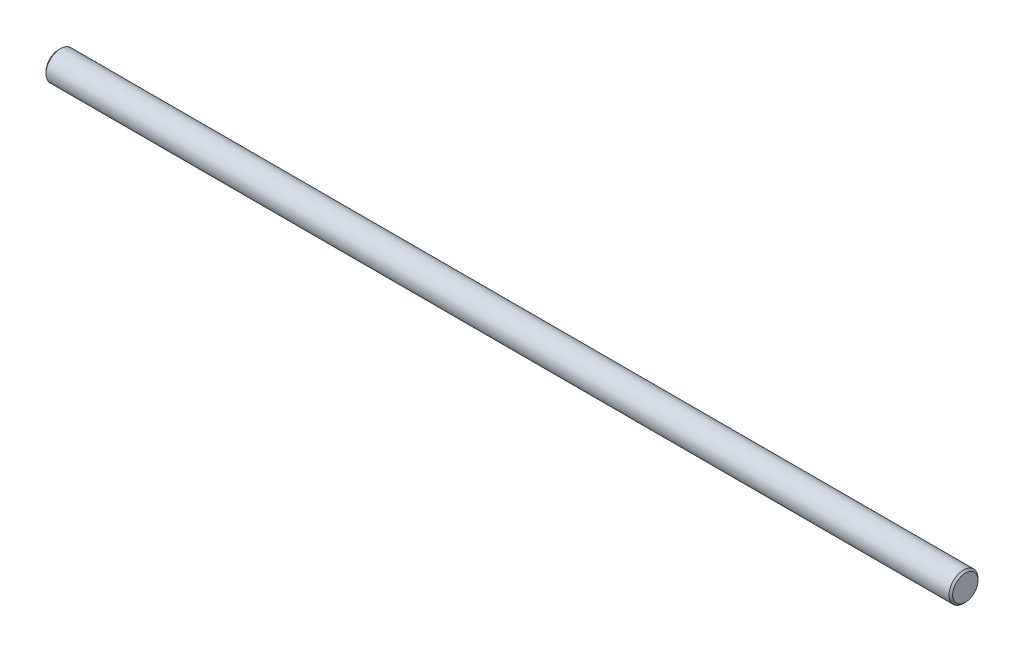
from build123d import *

# Parameters (mm, degrees)
SKETCH1_W     = 250
SKETCH1_H     = 4
CHAMFER1_SIZE = 0.5


with BuildPart() as part:
    # Sketch1 → Revolve1 (revolve)
    with BuildSketch(Plane.XY):
        with Locations((125, 2)):
            Rectangle(SKETCH1_W, SKETCH1_H)
    revolve(axis=Axis((0, 0, 0), (1, 0, 0)))

    # Chamfer1
    chamfer1_edges = [part.edges().sort_by_distance(p)[0] for p in [
        (250, -4, 0),
        (0, -4, 0),
    ]]
    chamfer(chamfer1_edges, length=CHAMFER1_SIZE)


solid = part.part
